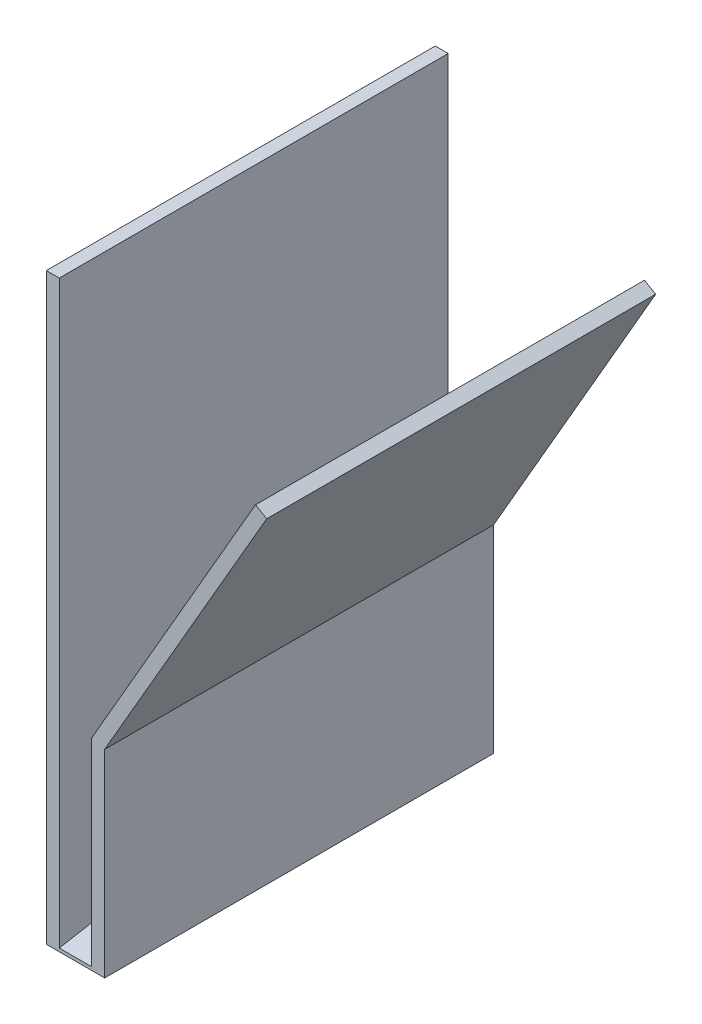
from build123d import *

# Parameters (mm, degrees)
SKETCH1_W           = 4
SKETCH1_H           = 180
BOSS_EXTRUDE1_DEPTH = 120
BOSS_EXTRUDE2_DEPTH = 10
BOSS_EXTRUDE3_DEPTH = 120


with BuildPart() as part:
    # Sketch1 → Boss-Extrude1 (new body)
    with BuildSketch(Plane.XY):
        with Locations((2, 90)):
            Rectangle(SKETCH1_W, SKETCH1_H)
    extrude(amount=BOSS_EXTRUDE1_DEPTH)

    # Sketch2 → Boss-Extrude2 (add)
    with BuildSketch(Plane(origin=(4, 0, 0), x_dir=(0, 0, -1), z_dir=(1, 0, 0))):
        Polygon((-120, 0), (-120, 1), (0, 22.159237685), (0, 0), align=None)
    extrude(amount=BOSS_EXTRUDE2_DEPTH)

    # Sketch4 → Boss-Extrude3 (add)
    with BuildSketch(Plane(origin=(0, 0, 0), x_dir=(-1, 0, 0), z_dir=(0, 0, -1))):
        Polygon((-14, 0), (-14, 62.159237685), (-64.535898385, 149.689981294), (-68, 147.689981294), (-18, 61.087440915), (-18, 0), align=None)
    extrude(amount=-BOSS_EXTRUDE3_DEPTH)


solid = part.part
